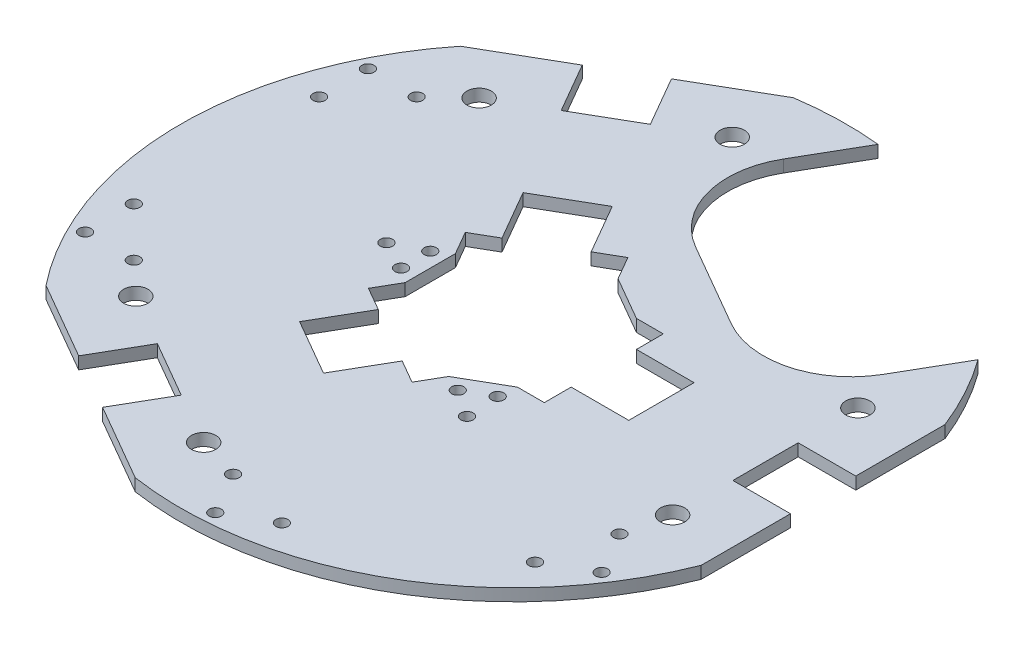
from build123d import *

# Parameters (mm, degrees)
SKETCH2_R                   = 88.9
BOSS_EXTRUDE1_DEPTH         = 3.175
SKETCH4_W                   = 15
SKETCH4_H                   = 17
SKETCH4_W_2                 = 21.412198496
SKETCH4_H_2                 = 63.5
CUT_EXTRUDE2_DEPTH          = 126.763669734
CIRPATTERN1_COUNT           = 3
CUT_EXTRUDE3_DEPTH          = 126.763669734
SKETCH8_R                   = 94.275983059
SKETCH8_R_2                 = 86.655983059
CUT_EXTRUDE_THIN1_DEPTH     = 126.763669734
SKETCH9_R                   = 3.175
CUT_EXTRUDE4_DEPTH          = 123.591188203
CIRPATTERN2_COUNT           = 3
SKETCH11_R                  = 1.5875
CUT_EXTRUDE6_DEPTH          = 123.591188203
CIRPATTERN3_COUNT           = 2
CIRPATTERN3_ANGLE           = 120
CIRPATTERN3_COPY_1_SKETCH_R = 1.5875
CIRPATTERN3_COPY_1_DEPTH    = 123.591188203
SKETCH12_R                  = 1.5875
CUT_EXTRUDE7_DEPTH          = 123.591188203
CIRPATTERN4_COUNT           = 2
CIRPATTERN4_ANGLE           = 120
CUT_EXTRUDE8_DEPTH          = 150
FILLET1_R                   = 22.86


with BuildPart() as part:
    # Sketch2 → Boss-Extrude1 (new body)
    with BuildSketch(Plane(origin=(0, 0, 0), x_dir=(1, 0, 0), z_dir=(0, 1, 0))):
        with Locations(Location((0, 0, 0), (0, 0, 270))):
            Circle(SKETCH2_R)
    extrude(amount=BOSS_EXTRUDE1_DEPTH)

    # Sketch4 → Cut-Extrude2 (cut, through all)
    with BuildSketch(Plane(origin=(0, 3.175, 0), x_dir=(1, 0, 0), z_dir=(0, 1, 0))):
        Polygon((23.51, 15.5), (16.51, 15.5), (16.51, -15.5), (23.51, -15.5), (23.51, -8.5), (23.51, 8.5), align=None)
        with Locations((73.13, 0)):
            Rectangle(SKETCH4_W, SKETCH4_H)
        with Locations((31.01, 0)):
            Rectangle(SKETCH4_W, SKETCH4_H)
        with Locations((91.336099248, 0)):
            Rectangle(SKETCH4_W_2, SKETCH4_H_2)
    cut_extrude2 = extrude(amount=-CUT_EXTRUDE2_DEPTH, mode=Mode.SUBTRACT)

    # CirPattern1: Cut-Extrude2 ×3 about axis
    cirpattern1_axis = Axis((0, 0, 0), (0, 1, 0))
    for i in range(1, CIRPATTERN1_COUNT):
        add(cut_extrude2.rotate(cirpattern1_axis, i * 360 / CIRPATTERN1_COUNT), mode=Mode.SUBTRACT)

    # Sketch6 → Cut-Extrude3 (cut, through all)
    with BuildSketch(Plane(origin=(0, 3.175, 0), x_dir=(1, 0, 0), z_dir=(0, 1, 0))):
        Polygon((-21.678393759, -6.548079416), (-21.678393759, 6.548079416), (5.168393759, 22.048079416), (16.51, 15.5), (16.51, -15.5), (5.168393759, -22.048079416), align=None)
    extrude(amount=-CUT_EXTRUDE3_DEPTH, mode=Mode.SUBTRACT)

    # Sketch8 → Cut-Extrude-Thin1 (cut, through all)
    with BuildSketch(Plane(origin=(0, 3.175, 0), x_dir=(1, 0, 0), z_dir=(0, 1, 0))):
        Circle(SKETCH8_R)
        Circle(SKETCH8_R_2, mode=Mode.SUBTRACT)
    extrude(amount=-CUT_EXTRUDE_THIN1_DEPTH, mode=Mode.SUBTRACT)

    # Sketch9 → Cut-Extrude4 (cut, through all)
    with BuildSketch(Plane(origin=(0, 3.175, 0), x_dir=(1, 0, 0), z_dir=(0, 1, 0))):
        with Locations(Location((65.549718535, 24.13, 0), (0, 0, 270))):
            Circle(SKETCH9_R)
        with Locations(Location((65.549718535, -24.13, 0), (0, 0, 90))):
            Circle(SKETCH9_R)
    cut_extrude4 = extrude(amount=-CUT_EXTRUDE4_DEPTH, mode=Mode.SUBTRACT)

    # CirPattern2: Cut-Extrude4 ×3 about axis
    cirpattern2_axis = Axis((0, 0, 0), (0, 1, 0))
    for i in range(1, CIRPATTERN2_COUNT):
        add(cut_extrude4.rotate(cirpattern2_axis, i * 360 / CIRPATTERN2_COUNT), mode=Mode.SUBTRACT)

    # Sketch11 → Cut-Extrude6 (cut, through all)
    with BuildSketch(Plane(origin=(0, 3.175, 0), x_dir=(1, 0, 0), z_dir=(0, 1, 0))):
        with Locations(Location((-74.764393759, 36.83, 0), (0, 0, 270))):
            Circle(SKETCH11_R)
        with Locations(Location((-62.064393759, 36.83, 0), (0, 0, 270))):
            Circle(SKETCH11_R)
        with Locations(Location((-74.764393759, 24.13, 0), (0, 0, 270))):
            Circle(SKETCH11_R)
    cut_extrude6 = extrude(amount=-CUT_EXTRUDE6_DEPTH, mode=Mode.SUBTRACT)

    # Mirror1: Cut-Extrude6 across plane
    add(cut_extrude6.mirror(Plane.XY), mode=Mode.SUBTRACT)

    # CirPattern3: Cut-Extrude6 ×2 about axis
    cirpattern3_axis = Axis((0, 0, 0), (0, 1, 0))
    for i in range(1, CIRPATTERN3_COUNT):
        add(cut_extrude6.rotate(cirpattern3_axis, i * CIRPATTERN3_ANGLE / (CIRPATTERN3_COUNT - 1)), mode=Mode.SUBTRACT)

    # CirPattern3 copy 1 sketch → CirPattern3 copy 1 (cut, through all)
    with BuildSketch(Plane(origin=(0, 3.175, 0), x_dir=(-0.5000000000000044, 0, -0.866025403784436), z_dir=(0, 1, 0))):
        with Locations((-74.764393759, -36.83)):
            Circle(CIRPATTERN3_COPY_1_SKETCH_R)
        with Locations((-62.064393759, -36.83)):
            Circle(CIRPATTERN3_COPY_1_SKETCH_R)
        with Locations((-74.764393759, -24.13)):
            Circle(CIRPATTERN3_COPY_1_SKETCH_R)
    extrude(amount=-CIRPATTERN3_COPY_1_DEPTH, mode=Mode.SUBTRACT)

    # Sketch12 → Cut-Extrude7 (cut, through all)
    with BuildSketch(Plane(origin=(0, 3.175, 0), x_dir=(1, 0, 0), z_dir=(0, 1, 0))):
        with Locations(Location((-33.108393759, 0, 0), (0, 0, 270))):
            Circle(SKETCH12_R)
        with BuildLine():
            ThreePointArc((-25.488393759, 5.3975), (-27.075893759, 3.81), (-25.488393759, 2.2225))
            Line((-25.488393759, 2.2225), (-25.488393759, 5.3975))
        make_face()
        with BuildLine():
            Line((-25.488393759, 5.3975), (-25.488393759, 2.2225))
            ThreePointArc((-25.488393759, 2.2225), (-24.365861744, 2.687467985), (-23.900893759, 3.81))
            ThreePointArc((-23.900893759, 3.81), (-24.365861744, 4.932532015), (-25.488393759, 5.3975))
        make_face()
        with BuildLine():
            ThreePointArc((-25.488393759, -2.2225), (-27.075893759, -3.81), (-25.488393759, -5.3975))
            Line((-25.488393759, -5.3975), (-25.488393759, -2.2225))
        make_face()
        with BuildLine():
            Line((-25.488393759, -2.2225), (-25.488393759, -5.3975))
            ThreePointArc((-25.488393759, -5.3975), (-24.365861744, -4.932532015), (-23.900893759, -3.81))
            ThreePointArc((-23.900893759, -3.81), (-24.365861744, -2.687467985), (-25.488393759, -2.2225))
        make_face()
    cut_extrude7 = extrude(amount=-CUT_EXTRUDE7_DEPTH, mode=Mode.SUBTRACT)

    # CirPattern4: Cut-Extrude7 ×2 about axis
    cirpattern4_axis = Axis((0, 0, 0), (0, 1, 0))
    for i in range(1, CIRPATTERN4_COUNT):
        add(cut_extrude7.rotate(cirpattern4_axis, i * CIRPATTERN4_ANGLE / (CIRPATTERN4_COUNT - 1)), mode=Mode.SUBTRACT)

    # Sketch10 → Cut-Extrude8 (cut)
    with BuildSketch(Plane(origin=(0, 3.175, 0), x_dir=(1, 0, 0), z_dir=(0, 1, 0))):
        Polygon((49.845863359, 15.215567884), (75.245863359, 59.209658396), (13.654136641, 94.769658396), (-11.745863359, 50.775567884), align=None)
    extrude(amount=-CUT_EXTRUDE8_DEPTH, mode=Mode.SUBTRACT)

    # Fillet1
    fillet1_edges = [part.edges().sort_by_distance(p)[0] for p in [
        (49.845863359, 1.5875, -15.215567884),
        (-11.745863359, 1.5875, -50.775567884),
    ]]
    fillet(fillet1_edges, radius=FILLET1_R)


solid = part.part
